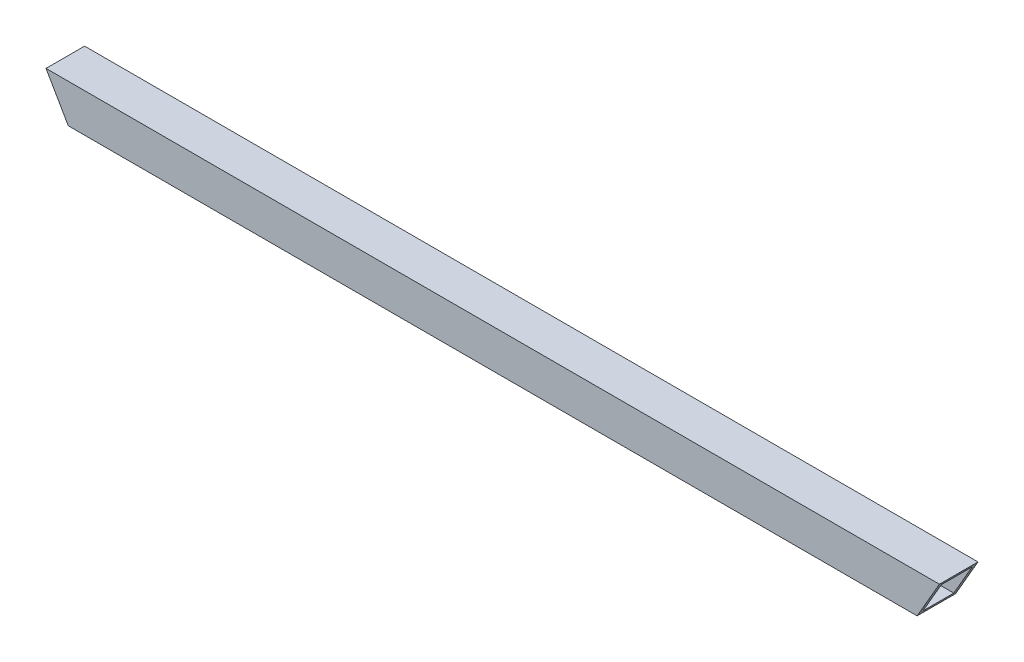
from build123d import *

# Parameters (mm, degrees)
BOSS_EXTRUDE1_DEPTH = 50
SKETCH4_W           = 40
SKETCH4_H           = 47.735026919
CUT_EXTRUDE1_DEPTH  = 1340.48308574


with BuildPart() as part:
    # Sketch3 → Boss-Extrude1 (new body)
    with BuildSketch(Plane.XY):
        Polygon((0, 0), (-1157.735026919, 0), (-1128.867513459, -50), (-28.867513459, -50), align=None)
    extrude(amount=BOSS_EXTRUDE1_DEPTH)

    # Sketch4 → Cut-Extrude1 (cut, through all, along a direction that is not the sketch's normal)
    with BuildSketch(Plane(origin=(0, 0, 0), x_dir=(0, 0, -1), z_dir=(0.8660254037844366, -0.5000000000000037, 0))):
        with Locations((-25, -28.86751346)):
            Rectangle(SKETCH4_W, SKETCH4_H)
    extrude(amount=-CUT_EXTRUDE1_DEPTH, dir=(1, 0, 0), mode=Mode.SUBTRACT)


solid = part.part
